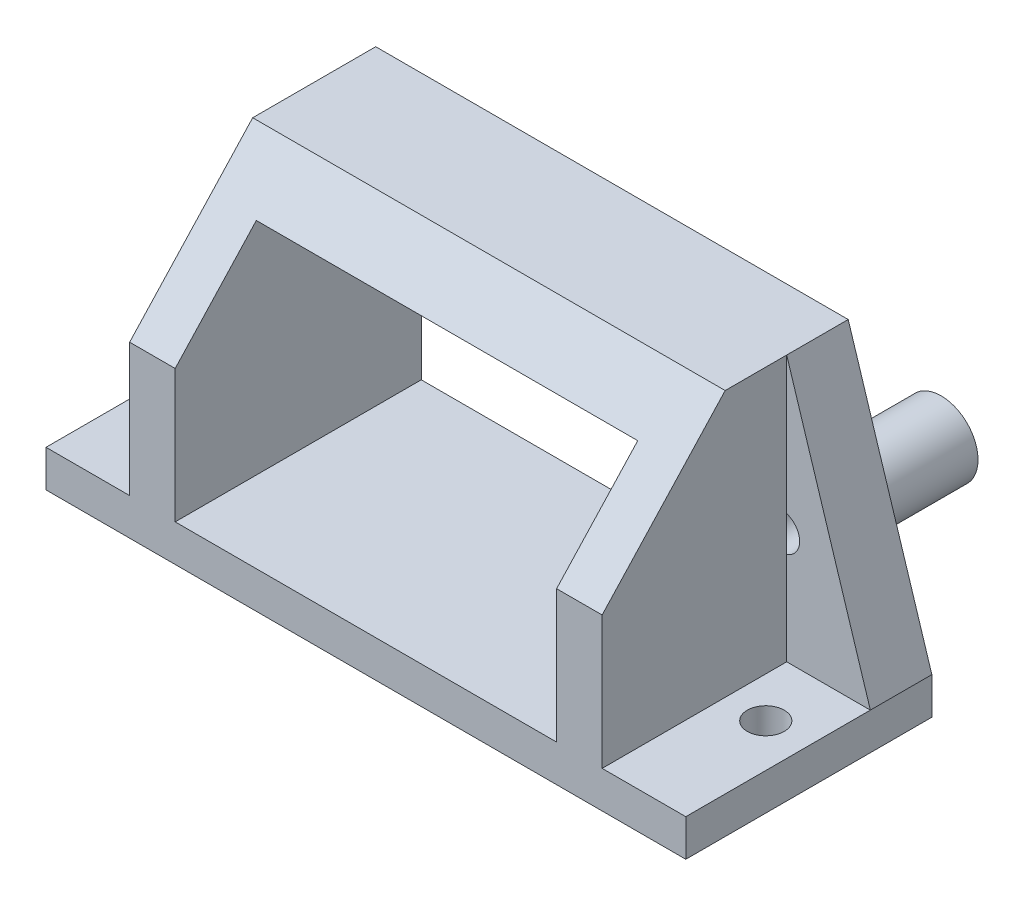
from build123d import *
from build123d.topology import SkipClean

# Parameters (mm, degrees)
SKETCH_1_W          = 31
SKETCH_1_H          = 17.919280428
EXTRUDE_1_DEPTH     = 20
CUT_EXTRUDE_1_DEPTH = 46
CUT_EXTRUDE_2_DEPTH = 15
SKETCH_4_R          = 1.5
CUT_EXTRUDE_3_DEPTH = 15
SKETCH_5_R          = 1.5
CUT_EXTRUDE_4_DEPTH = 10
SKETCH_6_R          = 3
SKETCH_6_R_2        = 1.5
EXTRUDE_2_DEPTH     = 8


with BuildPart() as part:
    # 草图1 → 凸台-拉伸1 (new body)
    with BuildSketch(Plane.XY):
        Polygon((-26, 0), (26, 0), (26, 3), (19.201257588, 24.596005308), (-19.201257588, 24.596005308), (-26, 3), align=None)
        with Locations((0, 11.959640214)):
            Rectangle(SKETCH_1_W, SKETCH_1_H, mode=Mode.SUBTRACT)
    extrude(amount=EXTRUDE_1_DEPTH)

    # 草图2 → 切除-拉伸1 (cut, symmetric)
    with BuildSketch(Plane(origin=(-15.5, 0, 0), x_dir=(0, 0, -1), z_dir=(1, 0, 0))):
        Polygon((-20, 13.798002654), (-10, 24.596005308), (-20, 24.596005308), align=None)
    extrude(amount=CUT_EXTRUDE_1_DEPTH, both=True, mode=Mode.SUBTRACT)

    # 草图3 → 切除-拉伸2 (cut)
    with BuildSketch(Plane.XY.offset(20)):
        Polygon((19.201257588, 24.596005308), (19.201257588, 3), (26, 3), align=None)
        Polygon((-19.201257588, 24.596005308), (-26, 3), (-19.201257588, 3), align=None)
    extrude(amount=-CUT_EXTRUDE_2_DEPTH, mode=Mode.SUBTRACT)

    # 草图4 → 切除-拉伸3 (cut)
    with BuildSketch(Plane.XZ):
        with Locations(Location((-22.5, 10, 0), (0, 0, 270))):
            Circle(SKETCH_4_R)
        with Locations(Location((22.5, 10, 0), (0, 0, 270))):
            Circle(SKETCH_4_R)
    extrude(amount=-CUT_EXTRUDE_3_DEPTH, mode=Mode.SUBTRACT)

    # 草图5 → 切除-拉伸4 (cut)
    with BuildSketch(Plane.XY.offset(5)):
        with Locations((-18.75, 12)):
            Circle(SKETCH_5_R)
        with Locations((18.75, 12)):
            Circle(SKETCH_5_R)
    extrude(amount=-CUT_EXTRUDE_4_DEPTH, mode=Mode.SUBTRACT)

    # 草图6 → 凸台-拉伸2 (add)
    # profile 1 of 2: a face of its own
    with SkipClean():  # the faces are left unmerged after this step: merging them gives an invalid solid
        with BuildSketch(Plane(origin=(0, 0, 0), x_dir=(-1, 0, 0), z_dir=(0, 0, -1))):
            with Locations(Location((18.75, 12, 0), (0, 0, 180))):
                Circle(SKETCH_6_R)
            with Locations(Location((18.75, 12, 0), (0, 0, 287.507965853))):
                Circle(SKETCH_6_R_2, mode=Mode.SUBTRACT)
        # profile 2 of 2: a face of its own
        with BuildSketch(Plane(origin=(0, 0, 0), x_dir=(-1, 0, 0), z_dir=(0, 0, -1))):
            with Locations(Location((-18.75, 12, 0), (0, 0, 180))):
                Circle(SKETCH_6_R)
            with Locations(Location((-18.75, 12, 0), (0, 0, 252.492034147))):
                Circle(SKETCH_6_R_2, mode=Mode.SUBTRACT)
        extrude(amount=EXTRUDE_2_DEPTH)


solid = part.part
